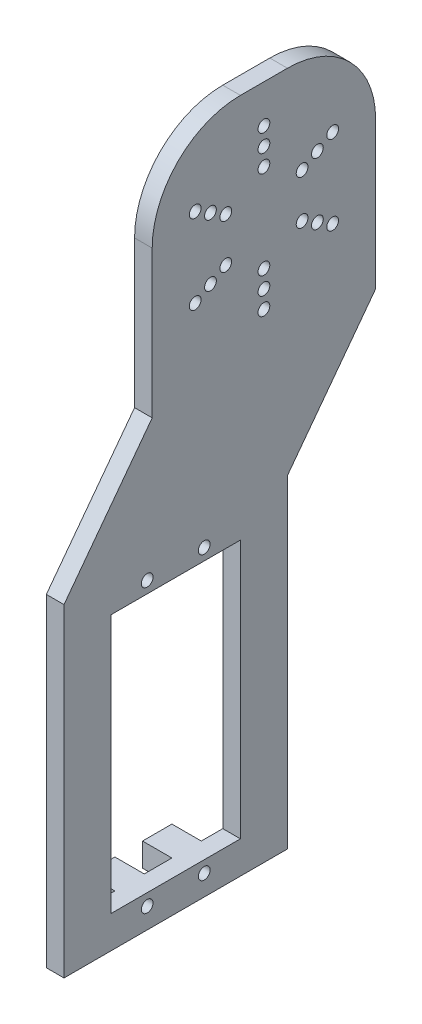
from build123d import *

# Parameters (mm, degrees)
SKETCH1_R           = 1
SKETCH1_W           = 22
SKETCH1_H           = 44
BOSS_EXTRUDE1_DEPTH = 1.5
FILLET1_R           = 15
BOSS_EXTRUDE2_START = -5
SKETCH2_W           = 5
SKETCH2_H           = 4
SKETCH2_R           = 1
BOSS_EXTRUDE2_DEPTH = 5


with BuildPart() as part:
    # Sketch1 → Boss-Extrude1 (new, symmetric)
    with BuildSketch(Plane(origin=(0, 0, 0), x_dir=(0, 0, -1), z_dir=(1, 0, 0))):
        Polygon((-19, -27.5), (19, -27.5), (19, 27.5), (34, 47.5), (34, 87.5), (-4, 87.5), (-4, 47.5), (-19, 27.5), align=None)
        with Locations((-4.85, -24)):
            Circle(SKETCH1_R, mode=Mode.SUBTRACT)
        with Locations((4.85, -24)):
            Circle(SKETCH1_R, mode=Mode.SUBTRACT)
        with Locations((4.85, 24)):
            Circle(SKETCH1_R, mode=Mode.SUBTRACT)
        with Locations((-4.85, 24)):
            Circle(SKETCH1_R, mode=Mode.SUBTRACT)
        with Locations((15, 75)):
            Circle(SKETCH1_R, mode=Mode.SUBTRACT)
        with Locations((15, 78)):
            Circle(SKETCH1_R, mode=Mode.SUBTRACT)
        with Locations((15, 81)):
            Circle(SKETCH1_R, mode=Mode.SUBTRACT)
        with Locations((21.495190528, 71.25)):
            Circle(SKETCH1_R, mode=Mode.SUBTRACT)
        with Locations((24.09326674, 72.75)):
            Circle(SKETCH1_R, mode=Mode.SUBTRACT)
        with Locations((26.691342951, 74.25)):
            Circle(SKETCH1_R, mode=Mode.SUBTRACT)
        with Locations((21.495190528, 63.75)):
            Circle(SKETCH1_R, mode=Mode.SUBTRACT)
        with Locations((24.09326674, 62.25)):
            Circle(SKETCH1_R, mode=Mode.SUBTRACT)
        with Locations((26.691342951, 60.75)):
            Circle(SKETCH1_R, mode=Mode.SUBTRACT)
        with Locations((15, 60)):
            Circle(SKETCH1_R, mode=Mode.SUBTRACT)
        with Locations((15, 57)):
            Circle(SKETCH1_R, mode=Mode.SUBTRACT)
        with Locations((15, 54)):
            Circle(SKETCH1_R, mode=Mode.SUBTRACT)
        with Locations((8.504809472, 63.75)):
            Circle(SKETCH1_R, mode=Mode.SUBTRACT)
        with Locations((5.90673326, 62.25)):
            Circle(SKETCH1_R, mode=Mode.SUBTRACT)
        with Locations((3.308657049, 60.75)):
            Circle(SKETCH1_R, mode=Mode.SUBTRACT)
        with Locations((8.504809472, 71.25)):
            Circle(SKETCH1_R, mode=Mode.SUBTRACT)
        with Locations((5.90673326, 72.75)):
            Circle(SKETCH1_R, mode=Mode.SUBTRACT)
        with Locations((3.308657049, 74.25)):
            Circle(SKETCH1_R, mode=Mode.SUBTRACT)
        Rectangle(SKETCH1_W, SKETCH1_H, mode=Mode.SUBTRACT)
    extrude(amount=BOSS_EXTRUDE1_DEPTH, both=True)

    # Fillet1
    fillet1_edges = [part.edges().sort_by_distance(p)[0] for p in [
        (0, 87.5, 4),
        (0, 87.5, -34),
    ]]
    fillet(fillet1_edges, radius=FILLET1_R)

    # Sketch2 → Boss-Extrude2 (add)
    # profile 1 of 4: a face of its own
    with BuildSketch(Plane(origin=(-1.5, 0, 0), x_dir=(0, 0, -1), z_dir=(1, 0, 0)).offset(BOSS_EXTRUDE2_START)):
        with Locations((-4.85, -24)):
            Rectangle(SKETCH2_W, SKETCH2_H)
        with Locations((-4.85, -24)):
            Circle(SKETCH2_R, mode=Mode.SUBTRACT)
    # profile 2 of 4: a face of its own
    with BuildSketch(Plane(origin=(-1.5, 0, 0), x_dir=(0, 0, -1), z_dir=(1, 0, 0)).offset(BOSS_EXTRUDE2_START)):
        with Locations((4.85, -24)):
            Rectangle(SKETCH2_W, SKETCH2_H)
        with Locations((4.85, -24)):
            Circle(SKETCH2_R, mode=Mode.SUBTRACT)
    # profile 3 of 4: a face of its own
    with BuildSketch(Plane(origin=(-1.5, 0, 0), x_dir=(0, 0, -1), z_dir=(1, 0, 0)).offset(BOSS_EXTRUDE2_START)):
        with Locations((4.85, 24)):
            Rectangle(SKETCH2_W, SKETCH2_H)
        with Locations((4.85, 24)):
            Circle(SKETCH2_R, mode=Mode.SUBTRACT)
    # profile 4 of 4: a face of its own
    with BuildSketch(Plane(origin=(-1.5, 0, 0), x_dir=(0, 0, -1), z_dir=(1, 0, 0)).offset(BOSS_EXTRUDE2_START)):
        with Locations((-4.85, 24)):
            Rectangle(SKETCH2_W, SKETCH2_H)
        with Locations((-4.85, 24)):
            Circle(SKETCH2_R, mode=Mode.SUBTRACT)
    extrude(amount=BOSS_EXTRUDE2_DEPTH)


solid = part.part
